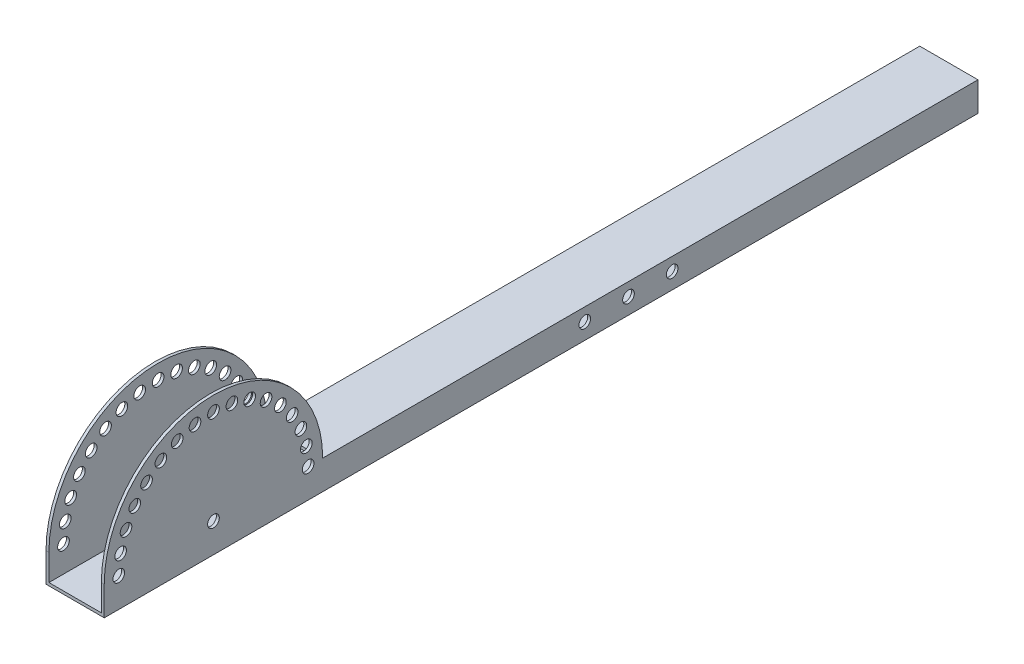
from build123d import *

# Parameters (mm, degrees)
SKETCH1_W           = 40
SKETCH1_H           = 20
SKETCH1_W_2         = 36
SKETCH1_H_2         = 16
BOSS_EXTRUDE1_DEPTH = 400
SKETCH2_R           = 4
CUT_EXTRUDE1_DEPTH  = 403.49223595
BOSS_EXTRUDE2_DEPTH = 2
SKETCH4_R           = 4
CUT_EXTRUDE2_DEPTH  = 409.931534612
SKETCH5_R           = 4
CUT_EXTRUDE3_DEPTH  = 409.931534612
CUT_EXTRUDE4_START  = -2
SKETCH7_W           = 36
SKETCH7_H           = 150
CUT_EXTRUDE4_DEPTH  = 2
SKETCH8_W           = 40
SKETCH8_H           = 20
SKETCH8_W_2         = 36
SKETCH8_H_2         = 16
BOSS_EXTRUDE3_DEPTH = 200


with BuildPart() as part:
    # Sketch1 → Boss-Extrude1 (new body)
    with BuildSketch(Plane.XY):
        with Locations((20, -10)):
            Rectangle(SKETCH1_W, SKETCH1_H)
        with Locations((20, -10)):
            Rectangle(SKETCH1_W_2, SKETCH1_H_2, mode=Mode.SUBTRACT)
    extrude(amount=BOSS_EXTRUDE1_DEPTH)

    # Sketch2 → Cut-Extrude1 (cut, through all)
    with BuildSketch(Plane(origin=(40, 0, 0), x_dir=(0, 0, -1), z_dir=(1, 0, 0))):
        with Locations((-10, -9)):
            Circle(SKETCH2_R)
        with Locations((-40, -9)):
            Circle(SKETCH2_R)
        with Locations((-70, -9)):
            Circle(SKETCH2_R)
    extrude(amount=-CUT_EXTRUDE1_DEPTH, mode=Mode.SUBTRACT)

    # Sketch3 → Boss-Extrude2 (add)
    with BuildSketch(Plane(origin=(40, 0, 0), x_dir=(0, 0, -1), z_dir=(1, 0, 0))):
        with BuildLine():
            Line((-400, 0), (-250, 0))
            ThreePointArc((-250, 0), (-325, 75), (-400, 0))
        make_face()
    boss_extrude2 = extrude(amount=-BOSS_EXTRUDE2_DEPTH)

    # Mirror1: Boss-Extrude2 across plane
    add(boss_extrude2.mirror(Plane(origin=(20, 0, 0), x_dir=(0, 0, 1), z_dir=(1, 0, 0))))

    # Sketch4 → Cut-Extrude2 (cut, through all)
    with BuildSketch(Plane(origin=(40, 0, 0), x_dir=(0, 0, -1), z_dir=(1, 0, 0))):
        with Locations((-390, 0)):
            Circle(SKETCH4_R)
        with Locations((-388.751043226, 12.680870931)):
            Circle(SKETCH4_R)
        with Locations((-385.052169613, 24.874423104)):
            Circle(SKETCH4_R)
        with Locations((-379.0455248, 36.112065146)):
            Circle(SKETCH4_R)
        with Locations((-370.961940777, 45.961940777)):
            Circle(SKETCH4_R)
        with Locations((-361.112065146, 54.0455248)):
            Circle(SKETCH4_R)
        with Locations((-349.874423104, 60.052169613)):
            Circle(SKETCH4_R)
        with Locations((-337.680870931, 63.751043226)):
            Circle(SKETCH4_R)
        with Locations((-325, 65)):
            Circle(SKETCH4_R)
        with Locations((-312.319129069, 63.751043226)):
            Circle(SKETCH4_R)
        with Locations((-300.125576896, 60.052169613)):
            Circle(SKETCH4_R)
        with Locations((-288.887934854, 54.0455248)):
            Circle(SKETCH4_R)
        with Locations((-279.038059223, 45.961940777)):
            Circle(SKETCH4_R)
        with Locations((-270.9544752, 36.112065146)):
            Circle(SKETCH4_R)
        with Locations((-264.947830387, 24.874423104)):
            Circle(SKETCH4_R)
        with Locations((-261.248956774, 12.680870931)):
            Circle(SKETCH4_R)
        with Locations((-260, 0)):
            Circle(SKETCH4_R)
    extrude(amount=-CUT_EXTRUDE2_DEPTH, mode=Mode.SUBTRACT)

    # Sketch5 → Cut-Extrude3 (cut, through all)
    with BuildSketch(Plane(origin=(40, 0, 0), x_dir=(0, 0, -1), z_dir=(1, 0, 0))):
        with Locations((-325, 0)):
            Circle(SKETCH5_R)
    extrude(amount=-CUT_EXTRUDE3_DEPTH, mode=Mode.SUBTRACT)

    # Sketch7 → Cut-Extrude4 (cut)
    with BuildSketch(Plane(origin=(0, 0, 0), x_dir=(1, 0, 0), z_dir=(0, 1, 0)).offset(CUT_EXTRUDE4_START)):
        with Locations((20, -325)):
            Rectangle(SKETCH7_W, SKETCH7_H)
    extrude(amount=CUT_EXTRUDE4_DEPTH, mode=Mode.SUBTRACT)

    # Sketch8 → Boss-Extrude3 (add)
    with BuildSketch(Plane(origin=(0, 0, 0), x_dir=(-1, 0, 0), z_dir=(0, 0, -1))):
        with Locations((-20, -10)):
            Rectangle(SKETCH8_W, SKETCH8_H)
        with Locations((-20, -10)):
            Rectangle(SKETCH8_W_2, SKETCH8_H_2, mode=Mode.SUBTRACT)
    extrude(amount=BOSS_EXTRUDE3_DEPTH)


solid = part.part
